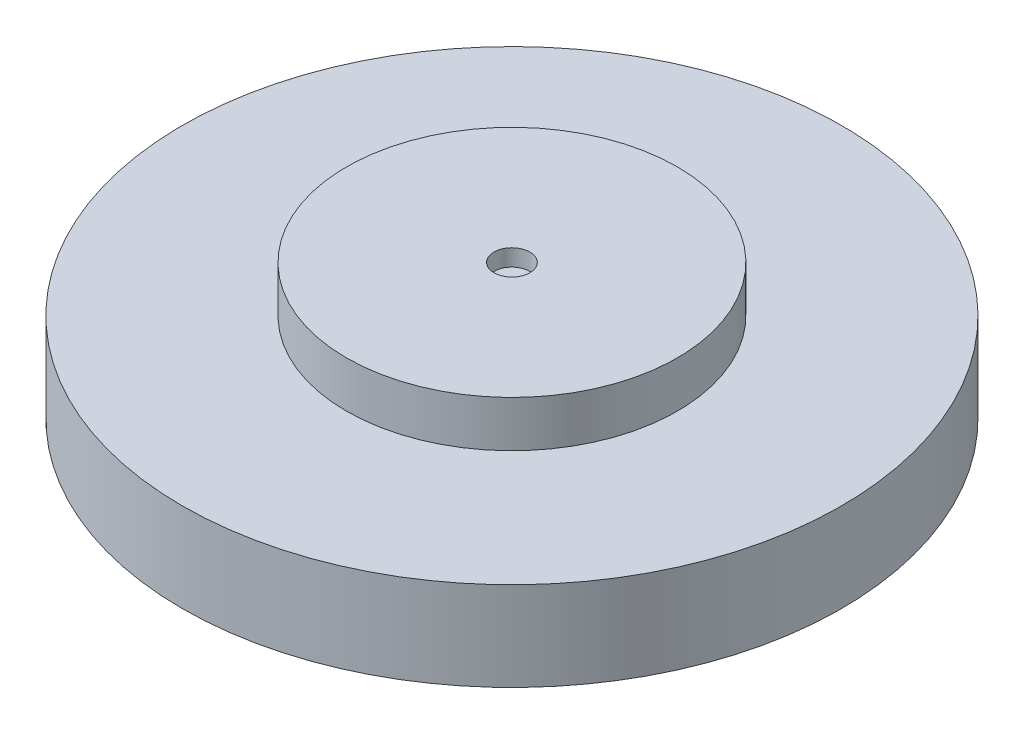
from build123d import *

# Parameters (mm, degrees)
SKETCH2_R           = 50
BOSS_EXTRUDE1_DEPTH = 13.5
SKETCH3_R           = 25.1
BOSS_EXTRUDE2_DEPTH = 7
SKETCH4_R           = 2.725
CUT_EXTRUDE1_DEPTH  = 2.55


with BuildPart() as part:
    # Sketch2 → Boss-Extrude1 (new body)
    with BuildSketch(Plane(origin=(0, 0, 0), x_dir=(1, 0, 0), z_dir=(0, 1, 0))):
        with Locations(Location((0, 0, 0), (0, 0, 270))):
            Circle(SKETCH2_R)
    extrude(amount=BOSS_EXTRUDE1_DEPTH)

    # Sketch3 → Boss-Extrude2 (add)
    with BuildSketch(Plane(origin=(0, 13.5, 0), x_dir=(1, 0, 0), z_dir=(0, 1, 0))):
        with Locations(Location((0, 0, 0), (0, 0, 270))):
            Circle(SKETCH3_R)
    extrude(amount=BOSS_EXTRUDE2_DEPTH)

    # Sketch4 → Cut-Extrude1 (cut)
    with BuildSketch(Plane(origin=(0, 20.5, 0), x_dir=(1, 0, 0), z_dir=(0, 1, 0))):
        with Locations(Location((0, 0, 0), (0, 0, 270))):
            Circle(SKETCH4_R)
    extrude(amount=-CUT_EXTRUDE1_DEPTH, mode=Mode.SUBTRACT)


solid = part.part
